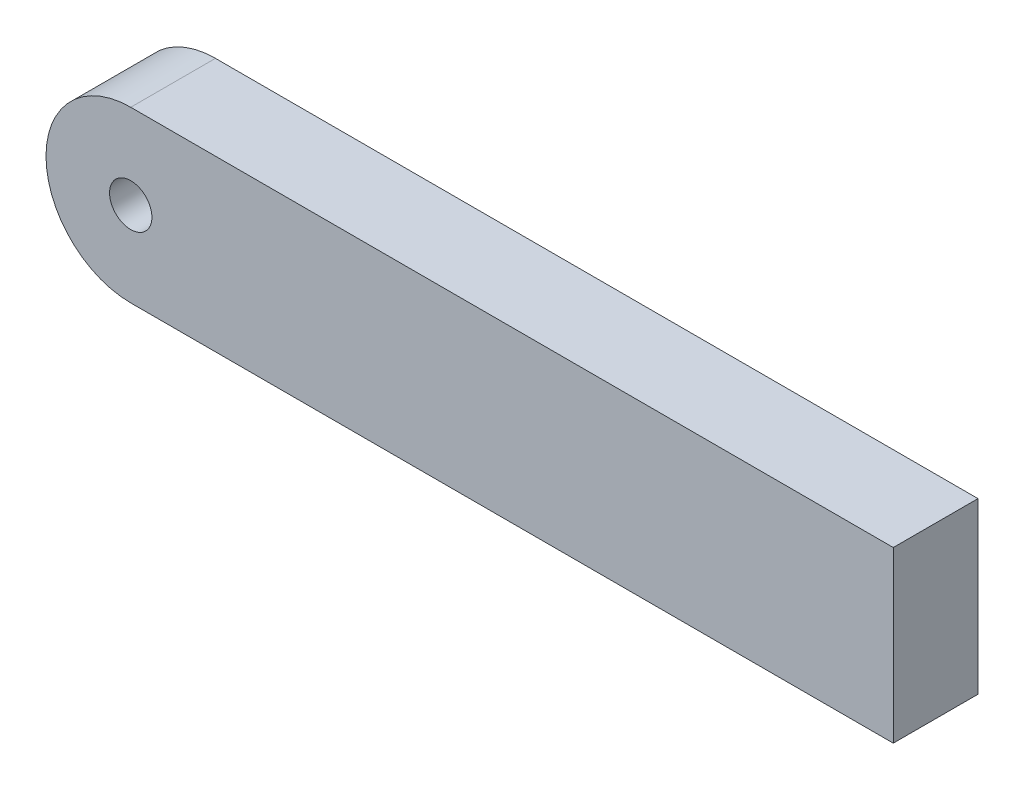
from build123d import *

# Parameters (mm, degrees)
SKETCH1_R           = 2.5
BOSS_EXTRUDE1_DEPTH = 10


with BuildPart() as part:
    # Sketch1 → Boss-Extrude1 (new body)
    with BuildSketch(Plane.XY):
        with BuildLine():
            Line((90, 10), (0, 10))
            ThreePointArc((0, 10), (-10, 0), (0, -10))
            Line((0, -10), (90, -10))
            Line((90, -10), (90, 10))
        make_face()
        Circle(SKETCH1_R, mode=Mode.SUBTRACT)
    extrude(amount=BOSS_EXTRUDE1_DEPTH)


solid = part.part
